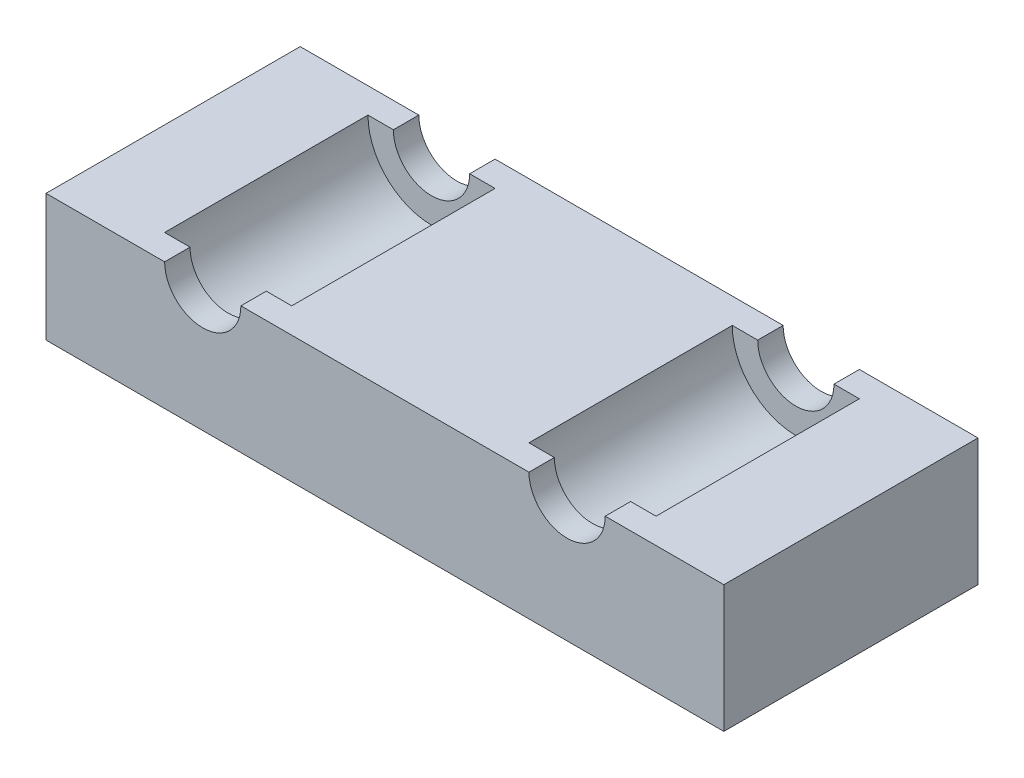
from build123d import *

# Parameters (mm, degrees)
SKETCH1_W               = 80
SKETCH1_H               = 30
BOSS_EXTRUDE1_DEPTH     = 15
SKETCH2_R               = 7.5
CUT_EXTRUDE1_DEPTH      = 87.746757864
SKETCH3_W               = 15
SKETCH3_H               = 3
BOSS_EXTRUDE2_DEPTH     = 10
CUT_EXTRUDE2_DEPTH      = 87.746757864
CUT_EXTRUDE2_DEPTH_BACK = 87.746757864
SKETCH4_R               = 4.5


with BuildPart() as part:
    # Sketch1 → Boss-Extrude1 (new body)
    with BuildSketch(Plane(origin=(0, 0, 0), x_dir=(1, 0, 0), z_dir=(0, 1, 0))):
        with Locations((40, 15)):
            Rectangle(SKETCH1_W, SKETCH1_H)
    extrude(amount=BOSS_EXTRUDE1_DEPTH)

    # Sketch2 → Cut-Extrude1 (cut, through all)
    with BuildSketch(Plane.XY):
        with Locations((18.5, 15)):
            Circle(SKETCH2_R)
        with Locations((61.5, 15)):
            Circle(SKETCH2_R)
    extrude(amount=-CUT_EXTRUDE1_DEPTH, mode=Mode.SUBTRACT)

    # Sketch3 → Boss-Extrude2 (add)
    with BuildSketch(Plane(origin=(0, 15, 0), x_dir=(1, 0, 0), z_dir=(0, 1, 0))):
        with Locations((18.5, 1.5)):
            Rectangle(SKETCH3_W, SKETCH3_H)
        with Locations((61.5, 28.5)):
            Rectangle(SKETCH3_W, SKETCH3_H)
        with Locations((61.5, 1.5)):
            Rectangle(SKETCH3_W, SKETCH3_H)
        with Locations((18.5, 28.5)):
            Rectangle(SKETCH3_W, SKETCH3_H)
    extrude(amount=-BOSS_EXTRUDE2_DEPTH)

    # Sketch4 → Cut-Extrude2 (cut, two sides: drawn at the far end of the back side and taken through both)
    with BuildSketch(Plane.XY.offset(-CUT_EXTRUDE2_DEPTH_BACK)):
        with Locations((18.5, 15)):
            Circle(SKETCH4_R)
        with Locations((61.5, 15)):
            Circle(SKETCH4_R)
    extrude(amount=CUT_EXTRUDE2_DEPTH + CUT_EXTRUDE2_DEPTH_BACK, mode=Mode.SUBTRACT)


solid = part.part
